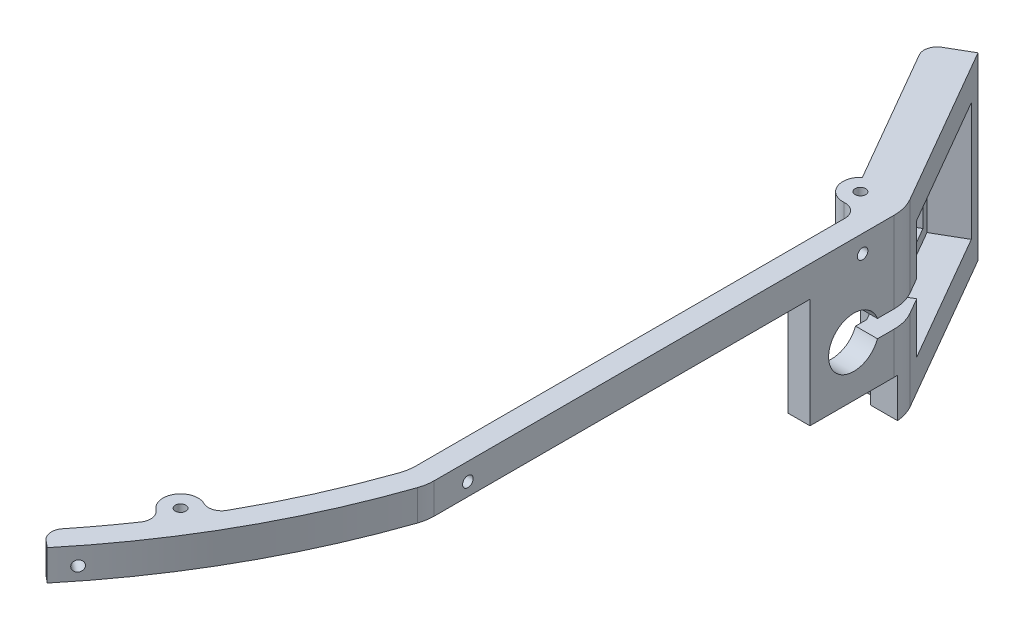
from build123d import *

# Parameters (mm, degrees)
BOSS_EXTRU_1_DEPTH                      = 7
ESQUISSE2_R                             = 4
ESQUISSE2_R_2                           = 1.2
BOSS_EXTRU_2_DEPTH                      = 7
CONG_1_R                                = 10
CONG_2_R                                = 3
BOSS_EXTRU_3_DEPTH                      = 41
ESQUISSE5_W                             = 29
ESQUISSE5_H                             = 22
ENL_V_MAT_EXTRU_1_DEPTH                 = 199.198296894
ESQUISSE7_W                             = 34
ESQUISSE7_H                             = 27
ENL_V_MAT_EXTRU_2_DEPTH                 = 7.4
ENL_V_START                             = -32
ESQUISSE8_W                             = 163.5
ESQUISSE8_H                             = 53
ENL_V_MAT_EXTRU_3_DEPTH                 = 170.279035308
ENL_V_MAT_EXTRU_4_DEPTH                 = 120.922123014
CONG_3_R                                = 3
DIAM_TRE_DU_PER_AGE_2_4_2_4_1_D         = 2.4
DIAM_TRE_DU_PER_AGE_2_4_2_4_1_ON_FACE_D = 2.4


with BuildPart() as part:
    # Esquisse1 → Boss.-Extru.1 (new body)
    with BuildSketch(Plane(origin=(0, 0, 0), x_dir=(1, 0, 0), z_dir=(0, 1, 0))):
        with BuildLine():
            Line((163.5, -54.314885969), (163.5, 54.839745962))
            Line((163.5, 54.839745962), (141, 93.810889132))
            Line((141, 93.810889132), (136.669872981, 91.310889132))
            Line((136.669872981, 91.310889132), (158.5, 53.5))
            Line((158.5, 53.5), (158.5, -53.5))
            ThreePointArc((158.5, -53.5), (146.077391865, -81.52236249), (128.750264504, -106.807627959))
            Line((128.750264504, -106.807627959), (132.598479772, -110))
            ThreePointArc((132.598479772, -110), (150.644566487, -83.59767596), (163.5, -54.314885969))
        make_face()
    extrude(amount=BOSS_EXTRU_1_DEPTH)

    # Esquisse2 → Boss.-Extru.2 (add)
    # profile 1 of 2: a face of its own
    with BuildSketch(Plane(origin=(0, 7, 0), x_dir=(1, 0, 0), z_dir=(0, 1, 0))):
        with Locations((155, 53)):
            Circle(ESQUISSE2_R)
        with Locations(Location((155, 53, 0), (0, 0, 270))):
            Circle(ESQUISSE2_R_2, mode=Mode.SUBTRACT)
    # profile 2 of 2: a face of its own
    with BuildSketch(Plane(origin=(0, 7, 0), x_dir=(1, 0, 0), z_dir=(0, 1, 0))):
        with Locations((140, -87)):
            Circle(ESQUISSE2_R)
        with Locations(Location((140, -87, 0), (0, 0, 270))):
            Circle(ESQUISSE2_R_2, mode=Mode.SUBTRACT)
    extrude(amount=-BOSS_EXTRU_2_DEPTH)

    # Congé1
    cong_1_edges = [part.edges().sort_by_distance(p)[0] for p in [
        (158.5, 3.5, 53.5),
        (163.5, 3.5, -54.839745962),
        (163.5, 3.5, 54.314885969),
    ]]
    fillet(cong_1_edges, radius=CONG_1_R)

    # Congé2
    cong_2_edges = [part.edges().sort_by_distance(p)[0] for p in [
        (128.750264504, 3.5, 106.807627959),
        (156.697559724, 3.5, -56.621918136),
        (158.5, 3.5, -51.063508327),
        (140.380940937, 3.5, 90.981819183),
        (143.738827918, 3.5, 85.578322891),
    ]]
    fillet(cong_2_edges, radius=CONG_2_R)

    # Esquisse4 → Boss.-Extru.3 (add)
    with BuildSketch(Plane(origin=(0, 7, 0), x_dir=(1, 0, 0), z_dir=(0, 1, 0))):
        with BuildLine():
            Line((162.160254038, 57.160254038), (141, 93.810889132))
            Line((141, 93.810889132), (133.205771366, 89.310889132))
            Line((133.205771366, 89.310889132), (153.015172443, 55))
            Line((153.015172443, 55), (155, 55))
            ThreePointArc((155, 55), (156, 54.732050808), (156.732050808, 54))
            Line((156.732050808, 54), (158.5, 50.937822174))
            Line((158.5, 50.937822174), (158.5, 33))
            Line((158.5, 33), (163.5, 33))
            Line((163.5, 33), (163.5, 52.160254038))
            ThreePointArc((163.5, 52.160254038), (163.159258263, 54.748444489), (162.160254038, 57.160254038))
        make_face()
    extrude(amount=-BOSS_EXTRU_3_DEPTH)

    # Esquisse5 → Enlèv. mat.-Extru.1 (cut, through all)
    with BuildSketch(Plane(origin=(146.37130657, 0, -84.50751325), x_dir=(-0.4999999999999999, 0, -0.8660254037844387), z_dir=(0.8660254037844387, 0, -0.4999999999999999))):
        with Locations((-10.417640898, -13.5)):
            Rectangle(ESQUISSE5_W, ESQUISSE5_H)
    extrude(amount=-ENL_V_MAT_EXTRU_1_DEPTH, mode=Mode.SUBTRACT)

    # Esquisse7 → Enlèv. mat.-Extru.2 (cut)
    with BuildSketch(Plane(origin=(146.37130657, 0, -84.50751325), x_dir=(-0.4999999999999999, 0, -0.8660254037844387), z_dir=(0.8660254037844387, 0, -0.4999999999999999))):
        with Locations((-10.417640898, -13.5)):
            Rectangle(ESQUISSE7_W, ESQUISSE7_H)
    extrude(amount=-ENL_V_MAT_EXTRU_2_DEPTH, mode=Mode.SUBTRACT)

    # Esquisse8 → Enlèv. mat.-Extru.3 (cut, through all)
    with BuildSketch(Plane(origin=(0, 7, 0), x_dir=(1, 0, 0), z_dir=(0, 1, 0)).offset(ENL_V_START)):
        with Locations((81.75, 26.5)):
            Rectangle(ESQUISSE8_W, ESQUISSE8_H)
    extrude(amount=-ENL_V_MAT_EXTRU_3_DEPTH, mode=Mode.SUBTRACT)

    # Esquisse9 → Enlèv. mat.-Extru.4 (cut, through all)
    with BuildSketch(Plane(origin=(163.5, 0, 0), x_dir=(0, 0, -1), z_dir=(1, 0, 0))):
        with BuildLine():
            Line((60.763139721, -11.5), (48.390964663, -11.5))
            ThreePointArc((48.390964663, -11.5), (37.25, -13.5), (48.390964663, -15.5))
            Line((48.390964663, -15.5), (60.763139721, -15.5))
            Line((60.763139721, -15.5), (60.763139721, -11.5))
        make_face()
    extrude(amount=-ENL_V_MAT_EXTRU_4_DEPTH, mode=Mode.SUBTRACT)

    # Congé3
    cong_3_edges = [part.edges().sort_by_distance(p)[0] for p in [
        (133.205771366, -13.5, -89.310889132),
    ]]
    fillet(cong_3_edges, radius=CONG_3_R)

    # Diamètre du perçage Ø2.4 (2.4)1 (through all)
    with Locations(Plane(origin=(135.734675085, 3, 106.105866084), x_dir=(-0.615871636874, 0, 0.787846512269), z_dir=(0.787846512269, 0, 0.615871636874))):
        with Locations((0, 0)):
            Hole(DIAM_TRE_DU_PER_AGE_2_4_2_4_1_D / 2)

    # Diamètre du perçage Ø2.4 (2.4)1 on face (through all)
    with Locations(Plane(origin=(163.5, 3, -45), x_dir=(0, 0, 1), z_dir=(1, 0, 0))):
        with Locations((0, 0), (90, 0)):
            Hole(DIAM_TRE_DU_PER_AGE_2_4_2_4_1_ON_FACE_D / 2)


solid = part.part
